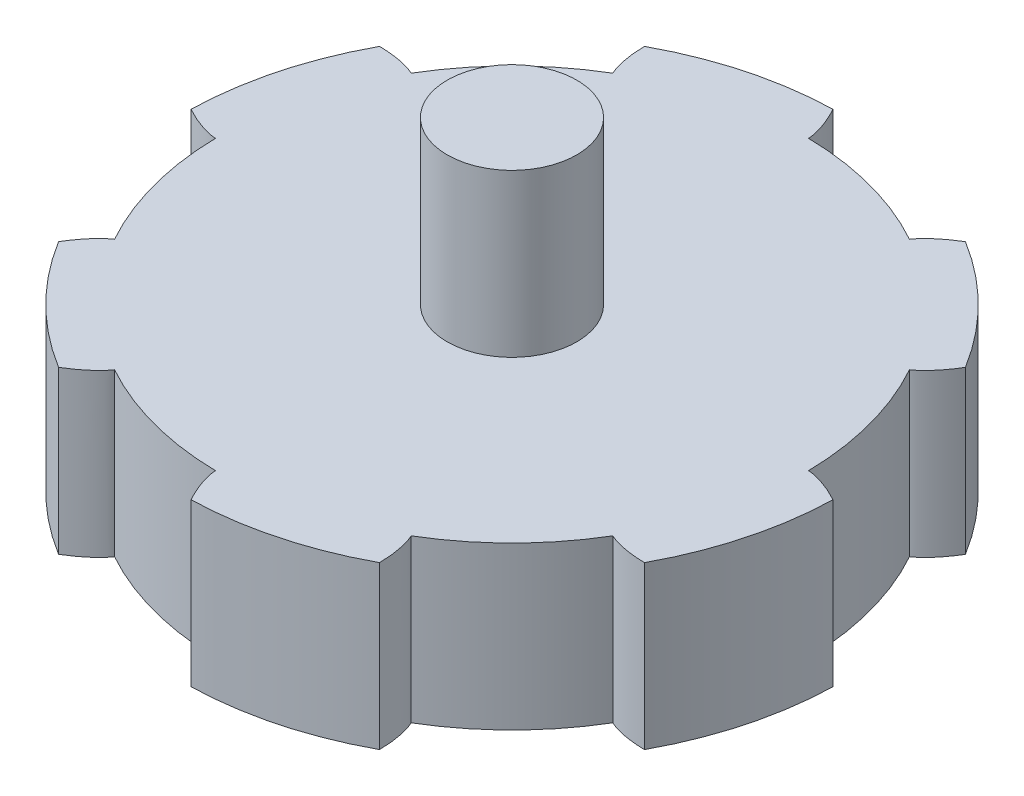
from build123d import *

# Parameters (mm, degrees)
SKETCH_1_R               = 18.042098319
EXTRUDE_1_DEPTH          = 10
EXTRUDE_2_DEPTH          = 10
PATTERN_CIRCULAR_1_COUNT = 6
SKETCH_5_R               = 4
EXTRUDE_3_DEPTH          = 10


with BuildPart() as part:
    # ｽｹｯﾁ1 → ﾎﾞｽ - 押し出し1 (new body)
    with BuildSketch(Plane(origin=(0, 0, 0), x_dir=(1, 0, 0), z_dir=(0, 1, 0))):
        with Locations(Location((0, 0, 0), (0, 0, 270))):
            Circle(SKETCH_1_R)
    extrude(amount=EXTRUDE_1_DEPTH)

    # ｽｹｯﾁ4 → ﾎﾞｽ - 押し出し2 (add)
    with BuildSketch(Plane(origin=(0, 0, 0), x_dir=(1, 0, 0), z_dir=(0, 1, 0))):
        with BuildLine():
            ThreePointArc((0.268896403, 18.040094414), (-4.669638659, 17.427328727), (-9.252918324, 15.488731848))
            add(Edge.make_bspline(
                [(-9.714533079, 17.890556389), (-9.709818433, 17.598094858), (-9.683773216, 17.175123253), (-9.606482839, 16.645312354), (-9.53966415, 16.315628537), (-9.468789573, 16.043783597), (-9.40010103, 15.828997964), (-9.331330572, 15.648985933), (-9.28257301, 15.54191839), (-9.252918324, 15.488731848)],
                knots=[0, 0, 0, 0, 0.356146416, 0.515080655, 0.651524593, 0.765478231, 0.856941573, 0.925914628, 1, 1, 1, 1], degree=3))
            ThreePointArc((-9.714533079, 17.890556389), (-5.269012673, 19.664223003), (-0.532245762, 20.35094286))
            add(Edge.make_bspline(
                [(-0.532245762, 20.35094286), (-0.390098, 20.095306422), (-0.201168016, 19.715979658), (-0.003197997, 19.218504772), (0.103777229, 18.899580866), (0.178320514, 18.628718954), (0.226227308, 18.408364869), (0.25667636, 18.218084648), (0.267984844, 18.100982654), (0.268896403, 18.040094414)],
                knots=[0, 0, 0, 0, 0.356146416, 0.515080655, 0.651524593, 0.765478231, 0.856941573, 0.925914628, 1, 1, 1, 1], degree=3))
        make_face()
    extrude_2 = extrude(amount=EXTRUDE_2_DEPTH)

    # 円形ﾊﾟﾀｰﾝ1: ﾎﾞｽ - 押し出し2 ×6 about axis
    pattern_circular_1_axis = Axis((0, 10, 0), (0, 1, 0))
    for i in range(1, PATTERN_CIRCULAR_1_COUNT):
        add(extrude_2.rotate(pattern_circular_1_axis, i * 360 / PATTERN_CIRCULAR_1_COUNT))

    # ｽｹｯﾁ5 → ﾎﾞｽ - 押し出し3 (add)
    with BuildSketch(Plane(origin=(0, 10, 0), x_dir=(1, 0, 0), z_dir=(0, 1, 0))):
        with Locations(Location((0, 0, 0), (0, 0, 270))):
            Circle(SKETCH_5_R)
    extrude(amount=EXTRUDE_3_DEPTH)


solid = part.part
